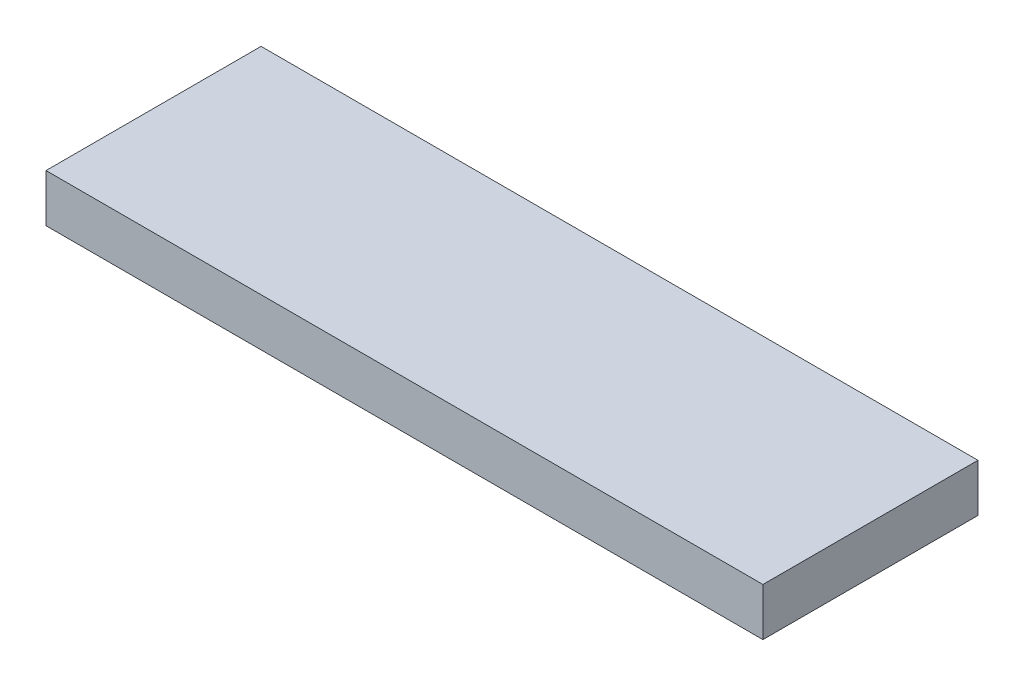
from build123d import *

# Parameters (mm, degrees)
SKETCH1_W           = 150
SKETCH1_H           = 45
BOSS_EXTRUDE1_DEPTH = 10


with BuildPart() as part:
    # Sketch1 → Boss-Extrude1 (new body)
    with BuildSketch(Plane(origin=(0, 0, 0), x_dir=(1, 0, 0), z_dir=(0, 1, 0))):
        Rectangle(SKETCH1_W, SKETCH1_H)
    extrude(amount=BOSS_EXTRUDE1_DEPTH)


solid = part.part
